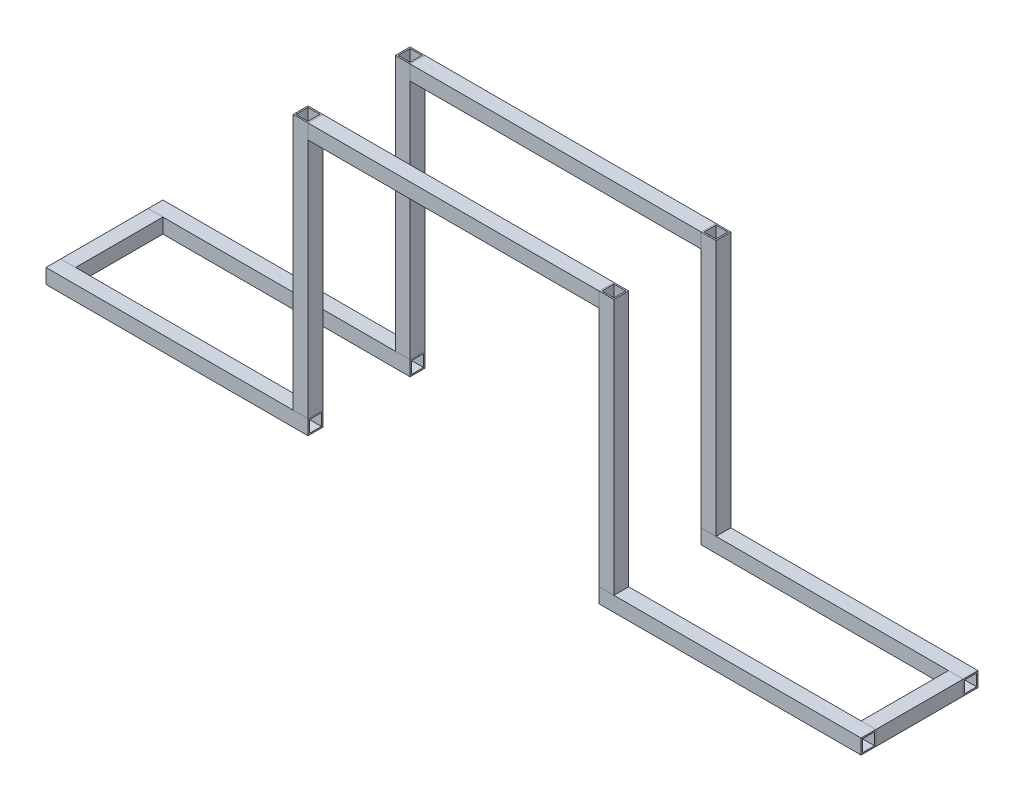
from build123d import *

# Parameters (mm, degrees)
SKETCH3_W             = 225
SKETCH3_H             = 12.7
BOSS_EXTRUDE1_DEPTH   = 12.7
SKETCH3_W_2           = 250
BOSS_EXTRUDE1_2_DEPTH = 12.7
BOSS_EXTRUDE1_3_DEPTH = 12.7
SHELL1_T              = -1.2
SHELL2_T              = -1.2
SHELL3_T              = -1.2
SKETCH3_3_W           = 12.7
SKETCH3_3_H           = 220
BOSS_EXTRUDE2_DEPTH   = 12.7
BOSS_EXTRUDE2_2_DEPTH = 12.7
SHELL4_T              = -1.2
SHELL5_T              = -1.2
SKETCH3_4_W           = 12.7
SKETCH3_4_H           = 12.7
BOSS_EXTRUDE3_DEPTH   = 75
BOSS_EXTRUDE3_2_DEPTH = 75
SHELL6_T              = -1.2
SHELL7_T              = -1.2


with BuildPart() as part:
    # Sketch3 → Boss-Extrude1 (new body)
    with BuildSketch(Plane.XY):
        with Locations((-237.5, 6.35)):
            Rectangle(SKETCH3_W, SKETCH3_H)
    extrude(amount=BOSS_EXTRUDE1_DEPTH)

    # Shell1
    shell1_openings = [part.faces().sort_by_distance(p)[0] for p in [
        (-125, 6.35, 6.35),
        (-350, 6.35, 6.35),
    ]]
    offset(amount=SHELL1_T, openings=shell1_openings, kind=Kind.INTERSECTION)


with BuildPart() as body_2:
    # Sketch3 → Boss-Extrude1 2 (new body)
    with BuildSketch(Plane.XY):
        with Locations((0, 226.35)):
            Rectangle(SKETCH3_W_2, SKETCH3_H)
    extrude(amount=BOSS_EXTRUDE1_2_DEPTH)

    # Shell2
    shell2_openings = [body_2.faces().sort_by_distance(p)[0] for p in [
        (-125, 226.35, 6.35),
        (125, 226.35, 6.35),
    ]]
    offset(amount=SHELL2_T, openings=shell2_openings, kind=Kind.INTERSECTION)


with BuildPart() as body_3:
    # Sketch3 → Boss-Extrude1 3 (new body)
    with BuildSketch(Plane.XY):
        with Locations((237.5, 6.35)):
            Rectangle(SKETCH3_W, SKETCH3_H)
    extrude(amount=BOSS_EXTRUDE1_3_DEPTH)

    # Shell3
    shell3_openings = [body_3.faces().sort_by_distance(p)[0] for p in [
        (125, 6.35, 6.35),
        (350, 6.35, 6.35),
    ]]
    offset(amount=SHELL3_T, openings=shell3_openings, kind=Kind.INTERSECTION)


with BuildPart() as body_4:
    # Sketch3<3> → Boss-Extrude2 (new body)
    with BuildSketch(Plane.XY):
        with Locations((-131.35, 122.7)):
            Rectangle(SKETCH3_3_W, SKETCH3_3_H)
    extrude(amount=BOSS_EXTRUDE2_DEPTH)

    # Shell4
    shell4_openings = [body_4.faces().sort_by_distance(p)[0] for p in [
        (-131.35, 232.7, 6.35),
        (-131.35, 12.7, 6.35),
    ]]
    offset(amount=SHELL4_T, openings=shell4_openings, kind=Kind.INTERSECTION)


with BuildPart() as body_5:
    # Sketch3<3> → Boss-Extrude2 2 (new body)
    with BuildSketch(Plane.XY):
        with Locations((131.35, 122.7)):
            Rectangle(SKETCH3_3_W, SKETCH3_3_H)
    extrude(amount=BOSS_EXTRUDE2_2_DEPTH)

    # Shell5
    shell5_openings = [body_5.faces().sort_by_distance(p)[0] for p in [
        (131.35, 232.7, 6.35),
        (131.35, 12.7, 6.35),
    ]]
    offset(amount=SHELL5_T, openings=shell5_openings, kind=Kind.INTERSECTION)


with BuildPart() as body_6:
    # Sketch3<4> → Boss-Extrude3 (new body)
    with BuildSketch(Plane.XY):
        with Locations((-343.65, 6.35)):
            Rectangle(SKETCH3_4_W, SKETCH3_4_H)
    extrude(amount=-BOSS_EXTRUDE3_DEPTH)

    # Shell7
    shell7_openings = [body_6.faces().sort_by_distance(p)[0] for p in [
        (-343.65, 6.35, -75),
        (-343.65, 6.35, 0),
    ]]
    offset(amount=SHELL7_T, openings=shell7_openings, kind=Kind.INTERSECTION)


with BuildPart() as body_7:
    # Sketch3<4> → Boss-Extrude3 2 (new body)
    with BuildSketch(Plane.XY):
        with Locations((343.65, 6.35)):
            Rectangle(SKETCH3_4_W, SKETCH3_4_H)
    extrude(amount=-BOSS_EXTRUDE3_2_DEPTH)

    # Shell6
    shell6_openings = [body_7.faces().sort_by_distance(p)[0] for p in [
        (343.65, 6.35, -75),
        (343.65, 6.35, 0),
    ]]
    offset(amount=SHELL6_T, openings=shell6_openings, kind=Kind.INTERSECTION)


with BuildPart() as body_8:
    # Mirror1: mirrored copy
    add(part.part.mirror(Plane.XY.offset(-37.5)))


with BuildPart() as body_9:
    # Mirror1 2: mirrored copy
    add(body_2.part.mirror(Plane.XY.offset(-37.5)))


with BuildPart() as body_10:
    # Mirror1 3: mirrored copy
    add(body_3.part.mirror(Plane.XY.offset(-37.5)))


with BuildPart() as body_11:
    # Mirror1 4: mirrored copy
    add(body_4.part.mirror(Plane.XY.offset(-37.5)))


with BuildPart() as body_12:
    # Mirror1 5: mirrored copy
    add(body_5.part.mirror(Plane.XY.offset(-37.5)))


solid = Compound([part.part, body_2.part, body_3.part, body_4.part, body_5.part, body_6.part, body_7.part, body_8.part, body_9.part, body_10.part, body_11.part, body_12.part])
